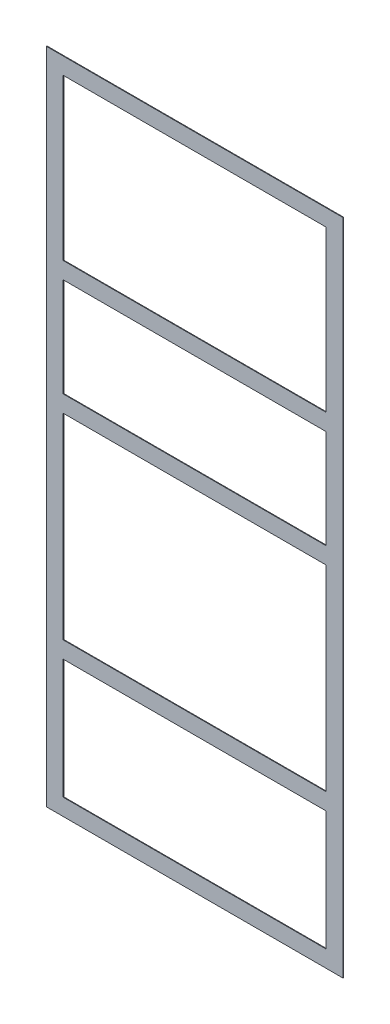
from build123d import *

# Parameters (mm, degrees)
CROQUIS1_W              = 900
CROQUIS1_H              = 2000
SALIENTE_EXTRUIR1_DEPTH = 1.9
CROQUIS2_W              = 798.4
CROQUIS2_H              = 363
CROQUIS2_H_2            = 596
CROQUIS2_H_3            = 300
CROQUIS2_H_4            = 487
CORTAR_EXTRUIR1_DEPTH   = 1.9


with BuildPart() as part:
    # Croquis1 → Saliente-Extruir1 (new body)
    with BuildSketch(Plane.XY):
        Rectangle(CROQUIS1_W, CROQUIS1_H)
    extrude(amount=SALIENTE_EXTRUIR1_DEPTH)

    # Croquis2 → Cortar-Extruir1 (cut)
    with BuildSketch(Plane.XY.offset(1.9)):
        with Locations((0, -767.7)):
            Rectangle(CROQUIS2_W, CROQUIS2_H)
        with Locations((0, -237.4)):
            Rectangle(CROQUIS2_W, CROQUIS2_H_2)
        with Locations((0, 261.4)):
            Rectangle(CROQUIS2_W, CROQUIS2_H_3)
        with Locations((0, 705.7)):
            Rectangle(CROQUIS2_W, CROQUIS2_H_4)
    extrude(amount=-CORTAR_EXTRUIR1_DEPTH, mode=Mode.SUBTRACT)


solid = part.part
